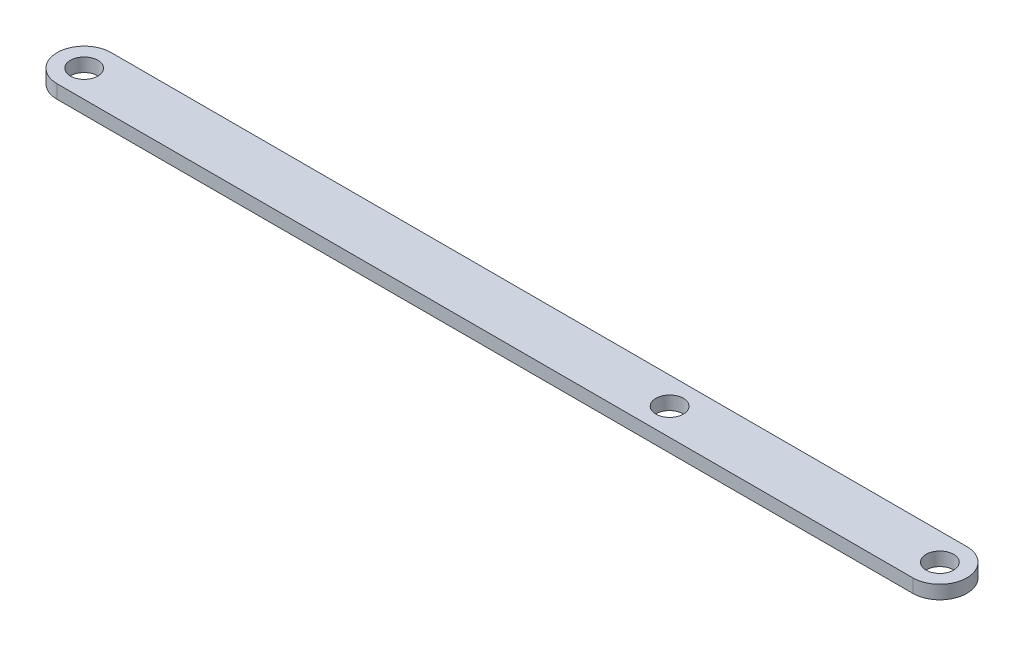
from build123d import *

# Parameters (mm, degrees)
SKETCH1_R           = 3.05
BOSS_EXTRUDE1_DEPTH = 3


with BuildPart() as part:
    # Sketch1 → Boss-Extrude1 (new body)
    with BuildSketch(Plane(origin=(0, 0, 0), x_dir=(1, 0, 0), z_dir=(0, 1, 0))):
        with BuildLine():
            Line((0, 6), (190, 6))
            ThreePointArc((190, 6), (196, 0), (190, -6))
            Line((190, -6), (0, -6))
            ThreePointArc((0, -6), (-6, 0), (0, 6))
        make_face()
        with Locations(Location((0, 0, 0), (0, 0, 270))):
            Circle(SKETCH1_R, mode=Mode.SUBTRACT)
        with Locations(Location((130, 0, 0), (0, 0, 270))):
            Circle(SKETCH1_R, mode=Mode.SUBTRACT)
        with Locations(Location((190, 0, 0), (0, 0, 270))):
            Circle(SKETCH1_R, mode=Mode.SUBTRACT)
    extrude(amount=BOSS_EXTRUDE1_DEPTH)


solid = part.part
